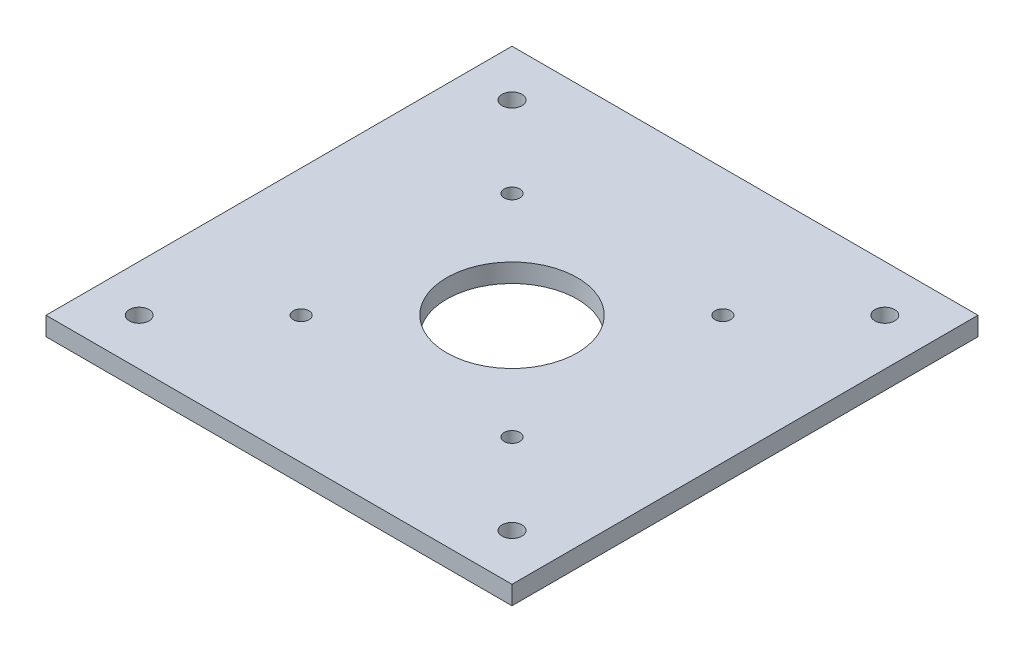
from build123d import *

# Parameters (mm, degrees)
ESBO_O1_W                               = 125
ESBO_O1_H                               = 125
RESSALTO_EXTRUS_O1_DEPTH                = 5
ESBO_O2_R                               = 17.5
CORTE_EXTRUS_O1_DEPTH                   = 89.529656048
BROCA_DE_ROSQUEAR_PARA_TARRAXA_DE_M51_D = 4.2
FURO_COM_FOLGA_DE_M51_D                 = 5.3


with BuildPart() as part:
    # Esboço1 → Ressalto-extrusão1 (new body)
    with BuildSketch(Plane(origin=(0, 0, 0), x_dir=(1, 0, 0), z_dir=(0, 1, 0))):
        Rectangle(ESBO_O1_W, ESBO_O1_H)
    extrude(amount=RESSALTO_EXTRUS_O1_DEPTH)

    # Esboço2 → Corte-extrusão1 (cut, through all)
    with BuildSketch(Plane(origin=(0, 5, 0), x_dir=(1, 0, 0), z_dir=(0, 1, 0))):
        with Locations(Location((0, 0, 0), (0, 0, 270))):
            Circle(ESBO_O2_R)
    extrude(amount=-CORTE_EXTRUS_O1_DEPTH, mode=Mode.SUBTRACT)

    # Broca de rosquear para tarraxa de M51 (through all)
    with Locations(Plane(origin=(0, 5, 0), x_dir=(1, 0, 0), z_dir=(0, 1, 0))):
        with Locations((28.284271247, 28.284271247), (28.284271247, -28.284271247), (-28.284271247, -28.284271247), (-28.284271247, 28.284271247)):
            Hole(BROCA_DE_ROSQUEAR_PARA_TARRAXA_DE_M51_D / 2)

    # Furo com folga de M51 (through all)
    with Locations(Plane(origin=(0, 5, 0), x_dir=(1, 0, 0), z_dir=(0, 1, 0))):
        with Locations((-50, -50), (-50, 50), (50, 50), (50, -50)):
            Hole(FURO_COM_FOLGA_DE_M51_D / 2)


solid = part.part
